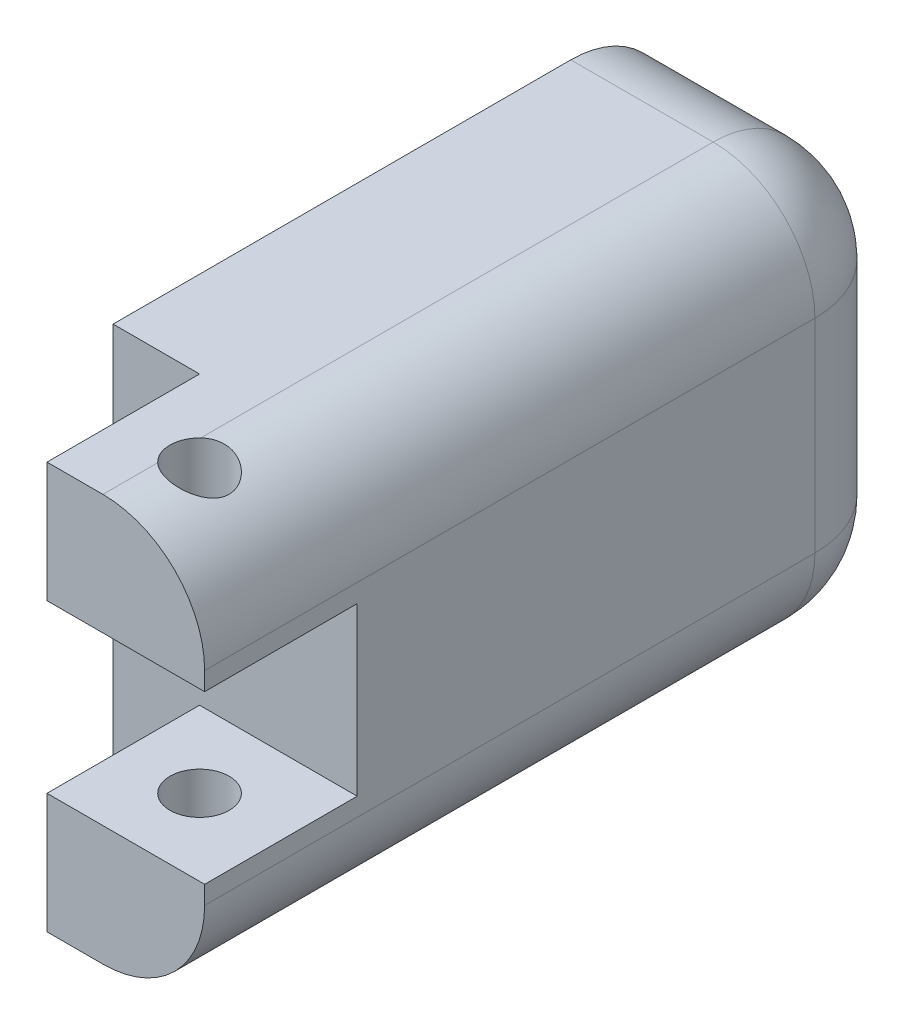
from build123d import *

# Parameters (mm, degrees)
EXTRUDE_1_DEPTH           = 20
FILLET_1_R                = 5
SKETCH_2_R                = 8
CUT_EXTRUDE_1_DEPTH       = 5
SKETCH_3_R                = 6
CUT_EXTRUDE_2_DEPTH       = 1
CUT_EXTRUDE_3_DEPTH       = 5
CUT_EXTRUDE_4_DEPTH       = 5
SKETCH_6_R                = 0.625
CUT_EXTRUDE_5_DEPTH       = 4
SKETCH_7_W                = 27
SKETCH_7_H                = 5
CUT_EXTRUDE_6_DEPTH       = 7
SKETCH_8_R                = 1.45
CUT_EXTRUDE_7_DEPTH       = 12
CUT_EXTRUDE_8_DEPTH       = 43.204857647
SKETCH_10_W               = 7.5
SKETCH_10_H               = 8.2
CUT_EXTRUDE_9_DEPTH       = 35.875672037
CUT_EXTRUDE_10_DEPTH      = 40.749968553
CUT_EXTRUDE_10_DEPTH_BACK = 40.749968553
SKETCH_11_R               = 1.455


with BuildPart() as part:
    # Эскиз1 → Бобышка-Вытянуть1 (new body)
    with BuildSketch(Plane(origin=(0, 0, 0), x_dir=(1, 0, 0), z_dir=(0, 1, 0))):
        Polygon((-13, 27.5), (-13, 0), (13, 0), (13, 27.5), (25, 27.5), (25, -7.5), (-25, -7.5), (-25, 27.5), align=None)
    extrude(amount=EXTRUDE_1_DEPTH)

    # Скругление1
    fillet_1_edges = [part.edges().sort_by_distance(p)[0] for p in [
        (19, 0, -27.5),
        (25, 10, -27.5),
        (-25, 10, -27.5),
        (-19, 20, -27.5),
        (-25, 20, -10),
        (25, 20, -10),
        (19, 20, -27.5),
        (25, 0, -10),
        (-25, 0, -10),
        (-19, 0, -27.5),
    ]]
    fillet(fillet_1_edges, radius=FILLET_1_R)

    # Эскиз2 → Вырез-Вытянуть1 (cut)
    with BuildSketch(Plane.ZY.offset(-13)):
        with Locations((-17.5, 10)):
            Circle(SKETCH_2_R)
    extrude(amount=-CUT_EXTRUDE_1_DEPTH, mode=Mode.SUBTRACT)

    # Эскиз3 → Вырез-Вытянуть2 (cut)
    with BuildSketch(Plane.ZY.offset(-18)):
        with Locations((-17.5, 10)):
            Circle(SKETCH_3_R)
    extrude(amount=-CUT_EXTRUDE_2_DEPTH, mode=Mode.SUBTRACT)

    # Эскиз4 → Вырез-Вытянуть3 (cut)
    with BuildSketch(Plane(origin=(-13, 0, 0), x_dir=(0, 0, -1), z_dir=(1, 0, 0))):
        with BuildLine():
            Line((13.195, 19.30212207), (2.9, 14.537620522))
            ThreePointArc((2.9, 14.537620522), (0, 10), (2.9, 5.462379478))
            Line((2.9, 5.462379478), (13.195, 0.69787793))
            ThreePointArc((13.195, 0.69787793), (27.75, 10), (13.195, 19.30212207))
        make_face()
    extrude(amount=-CUT_EXTRUDE_3_DEPTH, mode=Mode.SUBTRACT)

    # Эскиз5 → Вырез-Вытянуть4 (cut)
    with BuildSketch(Plane(origin=(-18, 0, 0), x_dir=(0, 0, -1), z_dir=(1, 0, 0))):
        with BuildLine():
            Line((19.4, 15.812916652), (19.4, 16.49838717))
            ThreePointArc((19.4, 16.49838717), (17.499999842, 18.39838717), (15.6, 16.498386854))
            Line((15.6, 16.498386854), (15.6, 15.665366642))
            ThreePointArc((15.6, 15.665366642), (15.094249889, 14.335999398), (13.832782732, 13.678959785))
            Line((13.832782732, 13.678959785), (1.932299859, 12.284367885))
            ThreePointArc((1.932299859, 12.284367885), (-0.1, 10), (1.932299859, 7.715632115))
            Line((1.932299859, 7.715632115), (13.832782732, 6.321040215))
            ThreePointArc((13.832782732, 6.321040215), (15.094249889, 5.664000602), (15.6, 4.334633358))
            Line((15.6, 4.334633358), (15.6, 3.501613146))
            ThreePointArc((15.6, 3.501613146), (17.5, 1.601613146), (19.4, 3.501613146))
            Line((19.4, 3.501613146), (19.4, 4.187083665))
            ThreePointArc((19.4, 4.187083665), (19.635266181, 5.128207436), (20.285714286, 5.847916677))
            ThreePointArc((20.285714286, 5.847916677), (22.5, 10), (20.285714286, 14.152083323))
            ThreePointArc((20.285714286, 14.152083323), (19.635266107, 14.871792704), (19.4, 15.812916652))
        make_face()
    extrude(amount=-CUT_EXTRUDE_4_DEPTH, mode=Mode.SUBTRACT)

    # Эскиз6 → Вырез-Вытянуть5 (cut)
    with BuildSketch(Plane(origin=(-23, 0, 0), x_dir=(0, 0, -1), z_dir=(1, 0, 0))):
        with Locations((2.278018202, 10)):
            Circle(SKETCH_6_R)
        with Locations((6.311115384, 10)):
            Circle(SKETCH_6_R)
        with Locations((10.428235425, 10)):
            Circle(SKETCH_6_R)
        with Locations((17.5, 14.907931149)):
            Circle(SKETCH_6_R)
        with Locations((17.5, 16.848859168)):
            Circle(SKETCH_6_R)
        with Locations((17.5, 5.082068851)):
            Circle(SKETCH_6_R)
        with Locations((17.5, 3.141140832)):
            Circle(SKETCH_6_R)
    extrude(amount=-CUT_EXTRUDE_5_DEPTH, mode=Mode.SUBTRACT)

    # Эскиз7 → Вырез-Вытянуть6 (cut)
    with BuildSketch(Plane.XY.offset(7.5)):
        with Locations((0, 17.5)):
            Rectangle(SKETCH_7_W, SKETCH_7_H)
        with Locations((0, 2.5)):
            Rectangle(SKETCH_7_W, SKETCH_7_H)
    extrude(amount=-CUT_EXTRUDE_6_DEPTH, mode=Mode.SUBTRACT)

    # Эскиз8 → Вырез-Вытянуть7 (cut)
    with BuildSketch(Plane(origin=(0, 15, 0), x_dir=(1, 0, 0), z_dir=(0, 1, 0))):
        with Locations(Location((-8.5, -4, 0), (0, 0, 270))):
            Circle(SKETCH_8_R)
        with Locations(Location((8.5, -4, 0), (0, 0, 270))):
            Circle(SKETCH_8_R)
    extrude(amount=-CUT_EXTRUDE_7_DEPTH, mode=Mode.SUBTRACT)

    # Эскиз9 → Вырез-Вытянуть8 (cut, through all)
    with BuildSketch(Plane.XZ):
        Polygon((13, 0), (17.25, 0), (17.25, 7.5), (-36.683406806, 12.049060371), (-29.579948377, -33.351304372), (-5.181112902, -33.351304372), (8.202214573, -2.26080516), align=None)
    extrude(amount=-CUT_EXTRUDE_8_DEPTH, mode=Mode.SUBTRACT)

    # Эскиз10 → Вырез-Вытянуть9 (cut, through all)
    with BuildSketch(Plane.ZY.offset(-17.25)):
        with Locations((3.75, 10)):
            Rectangle(SKETCH_10_W, SKETCH_10_H)
    extrude(amount=-CUT_EXTRUDE_9_DEPTH, mode=Mode.SUBTRACT)

    # Эскиз11 → Вырез-Вытянуть10 (cut, two sides: drawn at the far end of the back side and taken through both)
    with BuildSketch(Plane(origin=(0, 5.9, 0), x_dir=(1, 0, 0), z_dir=(0, 1, 0)).offset(-CUT_EXTRUDE_10_DEPTH_BACK)):
        with Locations(Location((21, -3.75, 0), (0, 0, 270))):
            Circle(SKETCH_11_R)
    extrude(amount=CUT_EXTRUDE_10_DEPTH + CUT_EXTRUDE_10_DEPTH_BACK, mode=Mode.SUBTRACT)


solid = part.part
